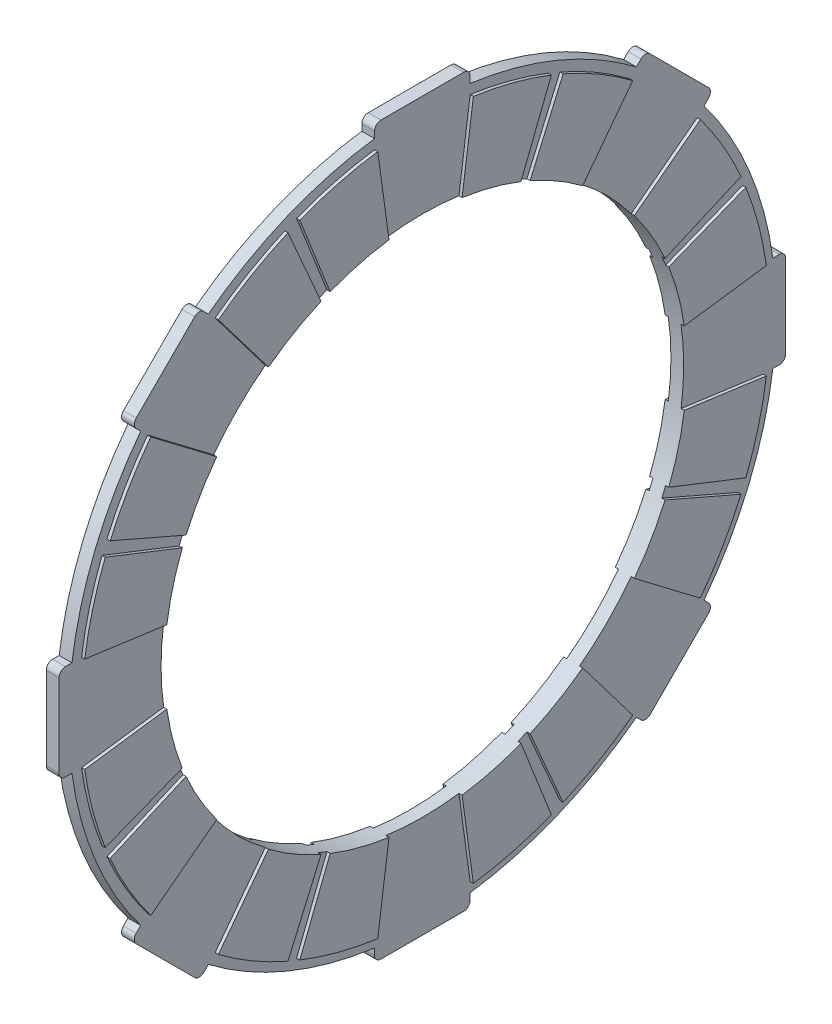
from build123d import *
from build123d.topology import SkipClean

# Parameters (mm, degrees)
SKETCH2_R                = 55.5
SKETCH2_R_2              = 41
BOSS_EXTRUDE1_DEPTH      = 1
BOSS_EXTRUDE2_DEPTH      = 1
FILLET1_R                = 1
CIRPATTERN1_COUNT        = 8
FILLET1_OF_CIRPATTERN1_R = 1
BOSS_EXTRUDE3_START      = -2.5
BOSS_EXTRUDE3_DEPTH      = 3
CIRPATTERN2_COUNT        = 8


with BuildPart() as part:
    # Sketch2 → Boss-Extrude1 (new, symmetric)
    with BuildSketch(Plane.YZ):
        Circle(SKETCH2_R)
        Circle(SKETCH2_R_2, mode=Mode.SUBTRACT)
    extrude(amount=BOSS_EXTRUDE1_DEPTH, both=True)

    # Sketch2<3> → Boss-Extrude2 (add, symmetric)
    with BuildSketch(Plane.YZ):
        with BuildLine():
            Line((7.5, 57.01), (-7.5, 57.01))
            Line((-7.5, 57.01), (-7.5, 54.990908339))
            ThreePointArc((-7.5, 54.990908339), (0, 55.5), (7.5, 54.990908339))
            Line((7.5, 54.990908339), (7.5, 57.01))
        make_face()
    boss_extrude2 = extrude(amount=BOSS_EXTRUDE2_DEPTH, both=True)

    # Fillet1
    fillet1_edges = [part.edges().sort_by_distance(p)[0] for p in [
        (0, -7.5, 57.01),
        (0, 7.5, 57.01),
    ]]
    fillet(fillet1_edges, radius=FILLET1_R)

    # CirPattern1: Boss-Extrude2 ×8 about axis
    cirpattern1_axis = Axis((1, 0, 0), (1, 0, 0))
    for i in range(1, CIRPATTERN1_COUNT):
        add(boss_extrude2.rotate(cirpattern1_axis, i * 360 / CIRPATTERN1_COUNT))

    # Fillet1 of CirPattern1
    fillet1_of_cirpattern1_edges = [part.edges().sort_by_distance(p)[0] for p in [
        (0, -45.615458454, 35.008856737),
        (0, -35.008856737, 45.615458454),
        (0, -57.01, -7.5),
        (0, -57.01, 7.5),
        (0, -35.008856737, -45.615458454),
        (0, -45.615458454, -35.008856737),
        (0, 7.5, -57.01),
        (0, -7.5, -57.01),
        (0, 45.615458454, -35.008856737),
        (0, 35.008856737, -45.615458454),
        (0, 57.01, 7.5),
        (0, 57.01, -7.5),
        (0, 35.008856737, 45.615458454),
        (0, 45.615458454, 35.008856737),
    ]]
    fillet(fillet1_of_cirpattern1_edges, radius=FILLET1_OF_CIRPATTERN1_R)

    # Sketch3 → Boss-Extrude3 (add)
    with SkipClean():  # the faces are left unmerged after this step: merging them gives an invalid solid
        with BuildSketch(Plane.YZ.offset(1).offset(BOSS_EXTRUDE3_START)):
            with BuildLine():
                Line((-5.735685634, 40.596821431), (-7.5, 53.47663041))
                ThreePointArc((-7.5, 53.47663041), (-13.713188223, 52.229766118), (-19.737522055, 50.263607343))
                Line((-19.737522055, 50.263607343), (-14.973002545, 38.168169917))
                ThreePointArc((-14.973002545, 38.168169917), (-10.425307121, 39.652401837), (-5.735685634, 40.596821431))
            make_face()
            with BuildLine():
                Line((-16.401460139, 37.576483408), (-21.58520191, 49.498273288))
                ThreePointArc((-21.58520191, 49.498273288), (-27.235333418, 46.628710186), (-32.510387139, 43.116988857))
                Line((-32.510387139, 43.116988857), (-24.650545522, 32.762029935))
                ThreePointArc((-24.650545522, 32.762029935), (-20.666676868, 35.41028759), (-16.401460139, 37.576483408))
            make_face()
        boss_extrude3 = extrude(amount=BOSS_EXTRUDE3_DEPTH)

    # CirPattern2: Boss-Extrude3 ×8 about axis
    with SkipClean():  # the faces are left unmerged after this step: merging them gives an invalid solid
        cirpattern2_axis = Axis((1, 0, 0), (1, 0, 0))
        for i in range(1, CIRPATTERN2_COUNT):
            add(boss_extrude3.rotate(cirpattern2_axis, i * 360 / CIRPATTERN2_COUNT))


solid = part.part
